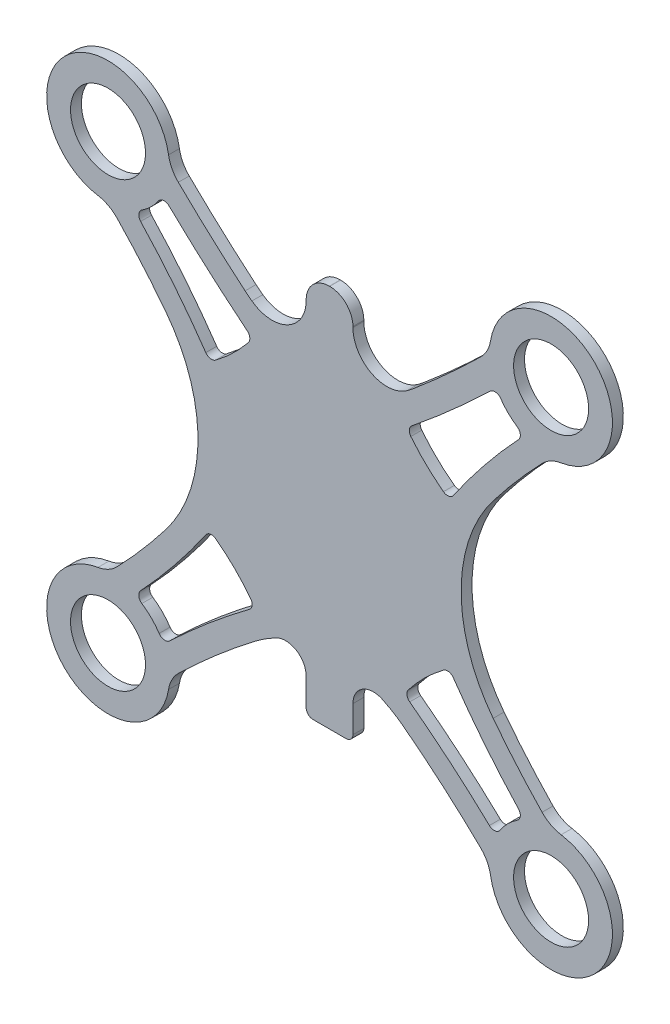
from build123d import *

# Parameters (mm, degrees)
BOSS_EXTRUDE1_DEPTH = 1.6
SKETCH1_5_R         = 5.5
CUT_EXTRUDE3_DEPTH  = 59.711668346


with BuildPart() as part:
    # Sketch1 → Boss-Extrude1 (new body)
    with BuildSketch(Plane.XY):
        with BuildLine():
            Line((-3.429, -22.169410702), (-3.429, -26.178))
            ThreePointArc((-3.429, -26.178), (-3.136106781, -26.885106781), (-2.429, -27.178))
            Line((-2.429, -27.178), (2.429, -27.178))
            ThreePointArc((2.429, -27.178), (3.136106781, -26.885106781), (3.429, -26.178))
            Line((3.429, -26.178), (3.429, -22.22966812))
            ThreePointArc((3.429, -22.22966812), (4.826254657, -19.693685595), (7.716471578, -19.519978666))
            ThreePointArc((7.716471578, -19.519978666), (9.379032197, -20.419956769), (10.937907763, -21.489524611))
            ThreePointArc((10.937907763, -21.489524611), (16.695290309, -26.175210804), (22.169453406, -31.188856909))
            ThreePointArc((22.169453406, -31.188856909), (23.117301861, -32.459556006), (23.619723106, -33.963107063))
            ThreePointArc((23.619723106, -33.963107063), (38.862466656, -38.865455055), (33.967276916, -23.620411133))
            ThreePointArc((33.967276916, -23.620411133), (32.455427267, -23.112806715), (31.180313141, -22.154978144))
            ThreePointArc((31.180313141, -22.154978144), (27.47385025, -18.084321842), (23.999156064, -13.81412159))
            ThreePointArc((23.999156064, -13.81412159), (20.509860624, -7.295108734), (19.304, 0))
            ThreePointArc((19.304, 0), (20.509860624, 7.295108734), (23.999156064, 13.81412159))
            ThreePointArc((23.999156064, 13.81412159), (27.47385025, 18.084321842), (31.180313141, 22.154978144))
            ThreePointArc((31.180313141, 22.154978144), (32.455427267, 23.112806715), (33.967276916, 23.620411133))
            ThreePointArc((33.967276916, 23.620411133), (38.861014354, 38.866906343), (23.61905648, 33.959055239))
            ThreePointArc((23.61905648, 33.959055239), (23.121622823, 32.463531472), (22.183380489, 31.19714571))
            ThreePointArc((22.183380489, 31.19714571), (17.368920037, 26.656724902), (12.387395689, 22.300250899))
            ThreePointArc((12.387395689, 22.300250899), (11.895164251, 21.899521015), (11.389978134, 21.515251299))
            ThreePointArc((11.389978134, 21.515251299), (6.171223513, 21.083006766), (3.429, 25.544222445))
            Line((3.429, 25.544222445), (3.429, 25.6764))
            ThreePointArc((3.429, 25.6764), (2.43210864, 28.08310864), (0.0254, 29.08))
            Line((0.0254, 29.08), (-0.0254, 29.08))
            ThreePointArc((-0.0254, 29.08), (-2.43210864, 28.08310864), (-3.429, 25.6764))
            Line((-3.429, 25.6764), (-3.429, 25.544222445))
            ThreePointArc((-3.429, 25.544222445), (-6.171223513, 21.083006766), (-11.389978134, 21.515251299))
            ThreePointArc((-11.389978134, 21.515251299), (-11.895164251, 21.899521015), (-12.387395689, 22.300250899))
            ThreePointArc((-12.387395689, 22.300250899), (-17.368920037, 26.656724902), (-22.183380489, 31.19714571))
            ThreePointArc((-22.183380489, 31.19714571), (-23.121622823, 32.463531472), (-23.61905648, 33.959055239))
            ThreePointArc((-23.61905648, 33.959055239), (-38.861014354, 38.866906343), (-33.967276916, 23.620411133))
            ThreePointArc((-33.967276916, 23.620411133), (-32.455427267, 23.112806715), (-31.180313141, 22.154978144))
            ThreePointArc((-31.180313141, 22.154978144), (-27.47385025, 18.084321842), (-23.999156064, 13.81412159))
            ThreePointArc((-23.999156064, 13.81412159), (-20.509860624, 7.295108734), (-19.304, 0))
            ThreePointArc((-19.304, 0), (-20.509860624, -7.295108734), (-23.999156064, -13.81412159))
            ThreePointArc((-23.999156064, -13.81412159), (-27.47385025, -18.084321842), (-31.180313141, -22.154978144))
            ThreePointArc((-31.180313141, -22.154978144), (-32.455427267, -23.112806715), (-33.967276916, -23.620411133))
            ThreePointArc((-33.967276916, -23.620411133), (-38.862466656, -38.865455055), (-23.619723106, -33.963107063))
            ThreePointArc((-23.619723106, -33.963107063), (-23.117301861, -32.459556006), (-22.169453406, -31.188856909))
            ThreePointArc((-22.169453406, -31.188856909), (-16.695290309, -26.175210804), (-10.937907763, -21.489524611))
            ThreePointArc((-10.937907763, -21.489524611), (-9.414925724, -20.426362093), (-7.803463878, -19.502793172))
            ThreePointArc((-7.803463878, -19.502793172), (-4.867492977, -19.607829975), (-3.429, -22.169410702))
        make_face()
    extrude(amount=BOSS_EXTRUDE1_DEPTH)

    # Sketch1<5> → Cut-Extrude3 (cut, through all)
    with BuildSketch(Plane.XY):
        with Locations((-32.5, -32.5)):
            Circle(SKETCH1_5_R)
        with Locations((32.5, -32.5)):
            Circle(SKETCH1_5_R)
        with Locations((32.5, 32.5)):
            Circle(SKETCH1_5_R)
        with Locations((-32.5, 32.5)):
            Circle(SKETCH1_5_R)
        with BuildLine():
            ThreePointArc((-24.998680714, -27.527052285), (-24.266539251, -27.975169466), (-23.452541635, -27.702684585))
            ThreePointArc((-23.452541635, -27.702684585), (-17.751335536, -22.602028101), (-11.761197607, -17.84401432))
            ThreePointArc((-11.761197607, -17.84401432), (-11.363038546, -17.168840008), (-11.563944828, -16.411193879))
            ThreePointArc((-11.563944828, -16.411193879), (-13.962913518, -13.697220596), (-16.710750131, -11.337115576))
            ThreePointArc((-16.710750131, -11.337115576), (-17.483496193, -11.148963344), (-18.155018506, -11.575103607))
            ThreePointArc((-18.155018506, -11.575103607), (-22.713350188, -17.692311571), (-27.713994469, -23.453576864))
            ThreePointArc((-27.713994469, -23.453576864), (-27.981074308, -24.266291585), (-27.532770213, -24.994893189))
            ThreePointArc((-27.532770213, -24.994893189), (-26.138464304, -26.133614559), (-24.998680714, -27.527052285))
        make_face()
        with BuildLine():
            ThreePointArc((18.155018506, -11.575103607), (17.483496193, -11.148963344), (16.710750131, -11.337115576))
            ThreePointArc((16.710750131, -11.337115576), (13.962913518, -13.697220596), (11.563944828, -16.411193879))
            ThreePointArc((11.563944828, -16.411193879), (11.363038546, -17.168840008), (11.761197607, -17.84401432))
            ThreePointArc((11.761197607, -17.84401432), (17.751335536, -22.602028101), (23.452541635, -27.702684585))
            ThreePointArc((23.452541635, -27.702684585), (24.266539251, -27.975169466), (24.998680714, -27.527052285))
            ThreePointArc((24.998680714, -27.527052285), (26.138464304, -26.133614559), (27.532770213, -24.994893189))
            ThreePointArc((27.532770213, -24.994893189), (27.981074308, -24.266291585), (27.713994469, -23.453576864))
            ThreePointArc((27.713994469, -23.453576864), (22.713350188, -17.692311571), (18.155018506, -11.575103607))
        make_face()
        with BuildLine():
            ThreePointArc((-12.074975691, 17.380952209), (-17.927124595, 22.331716527), (-23.562984675, 27.527368101))
            ThreePointArc((-23.562984675, 27.527368101), (-24.368188535, 27.806201558), (-25.102498374, 27.37389332))
            ThreePointArc((-25.102498374, 27.37389332), (-26.204243006, 26.068558181), (-27.532770213, 24.994893189))
            ThreePointArc((-27.532770213, 24.994893189), (-27.981074308, 24.266291585), (-27.713994469, 23.453576864))
            ThreePointArc((-27.713994469, 23.453576864), (-22.713350188, 17.692311571), (-18.155018506, 11.575103607))
            ThreePointArc((-18.155018506, 11.575103607), (-17.483496193, 11.148963344), (-16.710750131, 11.337115576))
            ThreePointArc((-16.710750131, 11.337115576), (-14.170722957, 13.494587833), (-11.922695283, 15.954830943))
            ThreePointArc((-11.922695283, 15.954830943), (-11.704234617, 16.699348887), (-12.074975691, 17.380952209))
        make_face()
        with BuildLine():
            ThreePointArc((25.102498374, 27.37389332), (24.368188535, 27.806201558), (23.562984675, 27.527368101))
            ThreePointArc((23.562984675, 27.527368101), (17.927124595, 22.331716527), (12.074975691, 17.380952209))
            ThreePointArc((12.074975691, 17.380952209), (11.704234617, 16.699348887), (11.922695283, 15.954830943))
            ThreePointArc((11.922695283, 15.954830943), (14.170722957, 13.494587833), (16.710750131, 11.337115576))
            ThreePointArc((16.710750131, 11.337115576), (17.483496193, 11.148963344), (18.155018506, 11.575103607))
            ThreePointArc((18.155018506, 11.575103607), (22.713350188, 17.692311571), (27.713994469, 23.453576864))
            ThreePointArc((27.713994469, 23.453576864), (27.981074308, 24.266291585), (27.532770213, 24.994893189))
            ThreePointArc((27.532770213, 24.994893189), (26.204243006, 26.068558181), (25.102498374, 27.37389332))
        make_face()
    extrude(amount=CUT_EXTRUDE3_DEPTH, mode=Mode.SUBTRACT)


solid = part.part
